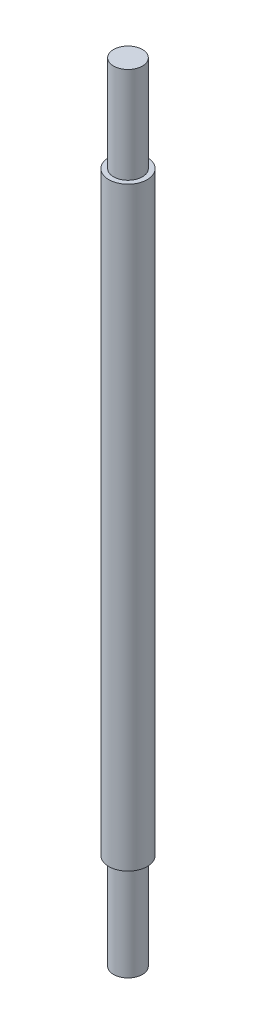
from build123d import *

# Parameters (mm, degrees)
SKETCH1_R           = 2
BOSS_EXTRUDE1_DEPTH = 62
SKETCH2_R           = 1.5
BOSS_EXTRUDE2_DEPTH = 10
BOSS_EXTRUDE3_START = 10
SKETCH3_R           = 1.5
BOSS_EXTRUDE3_DEPTH = 10


with BuildPart() as part:
    # Sketch1 → Boss-Extrude1 (new body)
    with BuildSketch(Plane(origin=(0, 0, 0), x_dir=(1, 0, 0), z_dir=(0, 1, 0))):
        with Locations(Location((0, 0, 0), (0, 0, 270))):
            Circle(SKETCH1_R)
    extrude(amount=BOSS_EXTRUDE1_DEPTH)

    # Sketch2 → Boss-Extrude2 (add)
    with BuildSketch(Plane(origin=(0, 62, 0), x_dir=(1, 0, 0), z_dir=(0, 1, 0))):
        with Locations(Location((0, 0, 0), (0, 0, 270))):
            Circle(SKETCH2_R)
    extrude(amount=BOSS_EXTRUDE2_DEPTH)

    # Sketch3 → Boss-Extrude3 (add)
    with BuildSketch(Plane.XZ.offset(BOSS_EXTRUDE3_START)):
        with Locations(Location((0, 0, 0), (0, 0, 90))):
            Circle(SKETCH3_R)
    extrude(amount=-BOSS_EXTRUDE3_DEPTH)


solid = part.part
